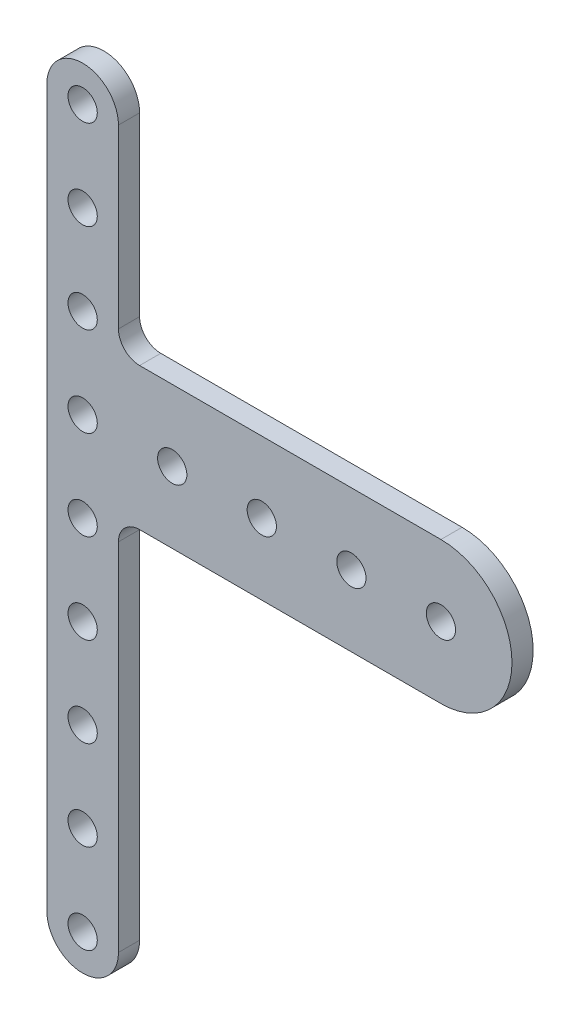
from build123d import *

# Parameters (mm, degrees)
SKETCH1_R           = 2.075
BOSS_EXTRUDE2_DEPTH = 1.5
FILLET2_R           = 3


with BuildPart() as part:
    # Sketch1 → Boss-Extrude2 (new, symmetric)
    with BuildSketch(Plane.XY):
        with BuildLine():
            Line((-5.075, 38.1), (-5.075, -63.5))
            ThreePointArc((-5.075, -63.5), (0, -68.575), (5.075, -63.5))
            Line((5.075, -63.5), (5.075, -10.075))
            Line((5.075, -10.075), (50.8, -10.075))
            ThreePointArc((50.8, -10.075), (60.875, 0), (50.8, 10.075))
            Line((50.8, 10.075), (5.075, 10.075))
            Line((5.075, 10.075), (5.075, 38.1))
            ThreePointArc((5.075, 38.1), (0, 43.175), (-5.075, 38.1))
        make_face()
        Circle(SKETCH1_R, mode=Mode.SUBTRACT)
        with Locations((12.7, 0)):
            Circle(SKETCH1_R, mode=Mode.SUBTRACT)
        with Locations((25.4, 0)):
            Circle(SKETCH1_R, mode=Mode.SUBTRACT)
        with Locations((38.1, 0)):
            Circle(SKETCH1_R, mode=Mode.SUBTRACT)
        with Locations((50.8, 0)):
            Circle(SKETCH1_R, mode=Mode.SUBTRACT)
        with Locations((0, 12.7)):
            Circle(SKETCH1_R, mode=Mode.SUBTRACT)
        with Locations((0, 25.4)):
            Circle(SKETCH1_R, mode=Mode.SUBTRACT)
        with Locations((0, 38.1)):
            Circle(SKETCH1_R, mode=Mode.SUBTRACT)
        with Locations((0, -12.7)):
            Circle(SKETCH1_R, mode=Mode.SUBTRACT)
        with Locations((0, -25.4)):
            Circle(SKETCH1_R, mode=Mode.SUBTRACT)
        with Locations((0, -38.1)):
            Circle(SKETCH1_R, mode=Mode.SUBTRACT)
        with Locations((0, -50.8)):
            Circle(SKETCH1_R, mode=Mode.SUBTRACT)
        with Locations((0, -63.5)):
            Circle(SKETCH1_R, mode=Mode.SUBTRACT)
    extrude(amount=BOSS_EXTRUDE2_DEPTH, both=True)

    # Fillet2
    fillet2_edges = [part.edges().sort_by_distance(p)[0] for p in [
        (5.075, 10.075, 0),
        (5.075, -10.075, 0),
    ]]
    fillet(fillet2_edges, radius=FILLET2_R)


solid = part.part
